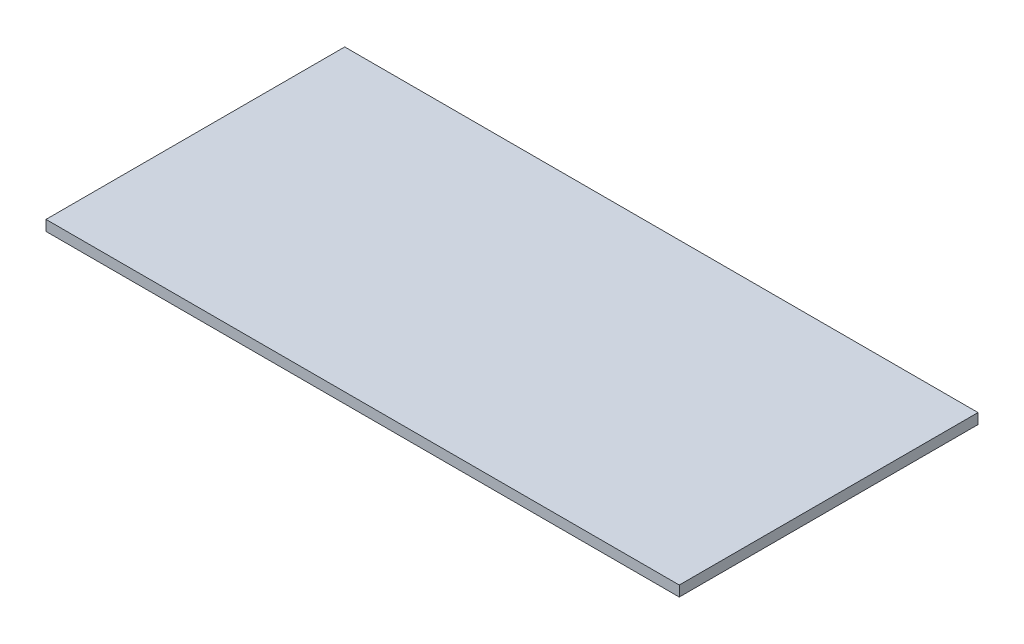
from build123d import *

# Parameters (mm, degrees)
SKETCH1_W           = 212
SKETCH1_H           = 100
BOSS_EXTRUDE1_DEPTH = 3.5


with BuildPart() as part:
    # Sketch1 → Boss-Extrude1 (new body)
    with BuildSketch(Plane(origin=(0, 0, 0), x_dir=(1, 0, 0), z_dir=(0, 1, 0))):
        with Locations((71.927408486, -24.930689111)):
            Rectangle(SKETCH1_W, SKETCH1_H)
    extrude(amount=BOSS_EXTRUDE1_DEPTH)


solid = part.part
